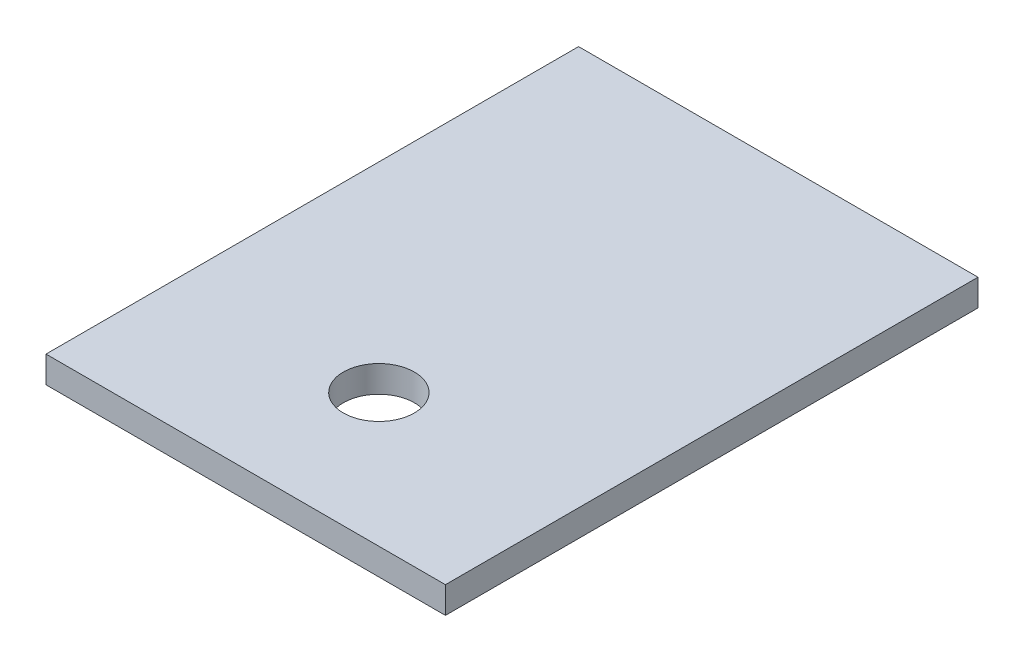
from build123d import *

# Parameters (mm, degrees)
SKETCH1_W           = 45
SKETCH1_H           = 60
SKETCH1_R           = 4
BOSS_EXTRUDE1_DEPTH = 3


with BuildPart() as part:
    # Sketch1 → Boss-Extrude1 (new body)
    with BuildSketch(Plane(origin=(0, 0, 0), x_dir=(1, 0, 0), z_dir=(0, 1, 0))):
        with Locations((22.5, 30)):
            Rectangle(SKETCH1_W, SKETCH1_H)
        with Locations(Location((22.5, 15, 0), (0, 0, 270))):
            Circle(SKETCH1_R, mode=Mode.SUBTRACT)
    extrude(amount=BOSS_EXTRUDE1_DEPTH)


solid = part.part
